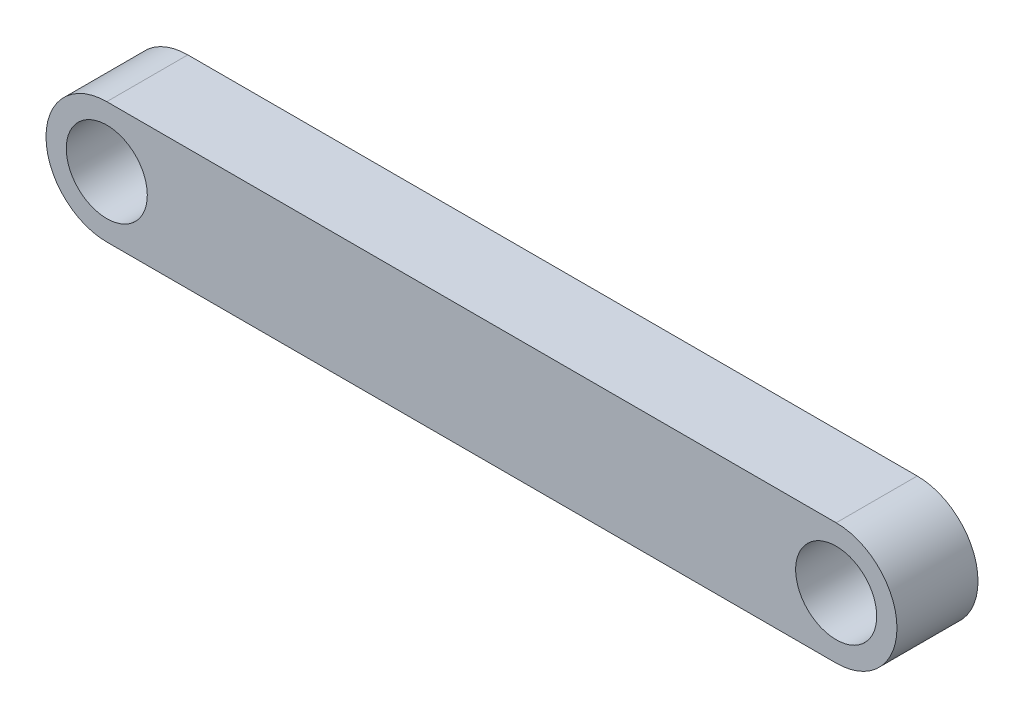
from build123d import *

# Parameters (mm, degrees)
SKETCH1_R           = 2
BOSS_EXTRUDE1_DEPTH = 4


with BuildPart() as part:
    # Sketch1 → Boss-Extrude1 (new body)
    with BuildSketch(Plane.XY):
        with BuildLine():
            Line((-17.858823529, 3), (18.141176471, 3))
            ThreePointArc((18.141176471, 3), (21.141176471, 0), (18.141176471, -3))
            Line((18.141176471, -3), (-17.858823529, -3))
            ThreePointArc((-17.858823529, -3), (-20.858823529, 0), (-17.858823529, 3))
        make_face()
        with Locations((-17.858823529, 0)):
            Circle(SKETCH1_R, mode=Mode.SUBTRACT)
        with Locations((18.141176471, 0)):
            Circle(SKETCH1_R, mode=Mode.SUBTRACT)
    extrude(amount=BOSS_EXTRUDE1_DEPTH)


solid = part.part
